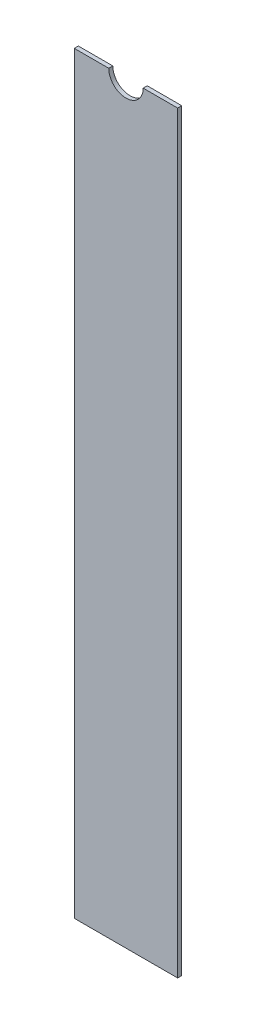
from build123d import *

# Parameters (mm, degrees)
SKETCH1_W           = 76.2
SKETCH1_H           = 584.2
SKETCH1_R           = 12.7
BOSS_EXTRUDE1_DEPTH = 3
SKETCH2_W           = 76.2
SKETCH2_H           = 28.777191139
CUT_OUT_DEPTH       = 586.4487595


with BuildPart() as part:
    # Sketch1 → Boss-Extrude1 (new body)
    with BuildSketch(Plane.XY):
        with Locations((0, 292.1)):
            Rectangle(SKETCH1_W, SKETCH1_H)
        with Locations((0, 555.422808861)):
            Circle(SKETCH1_R, mode=Mode.SUBTRACT)
    extrude(amount=BOSS_EXTRUDE1_DEPTH)

    # Sketch2 → Cut Out (cut, through all)
    with BuildSketch(Plane.XY.offset(3)):
        with Locations((0, 569.811404431)):
            Rectangle(SKETCH2_W, SKETCH2_H)
    extrude(amount=-CUT_OUT_DEPTH, mode=Mode.SUBTRACT)


solid = part.part
